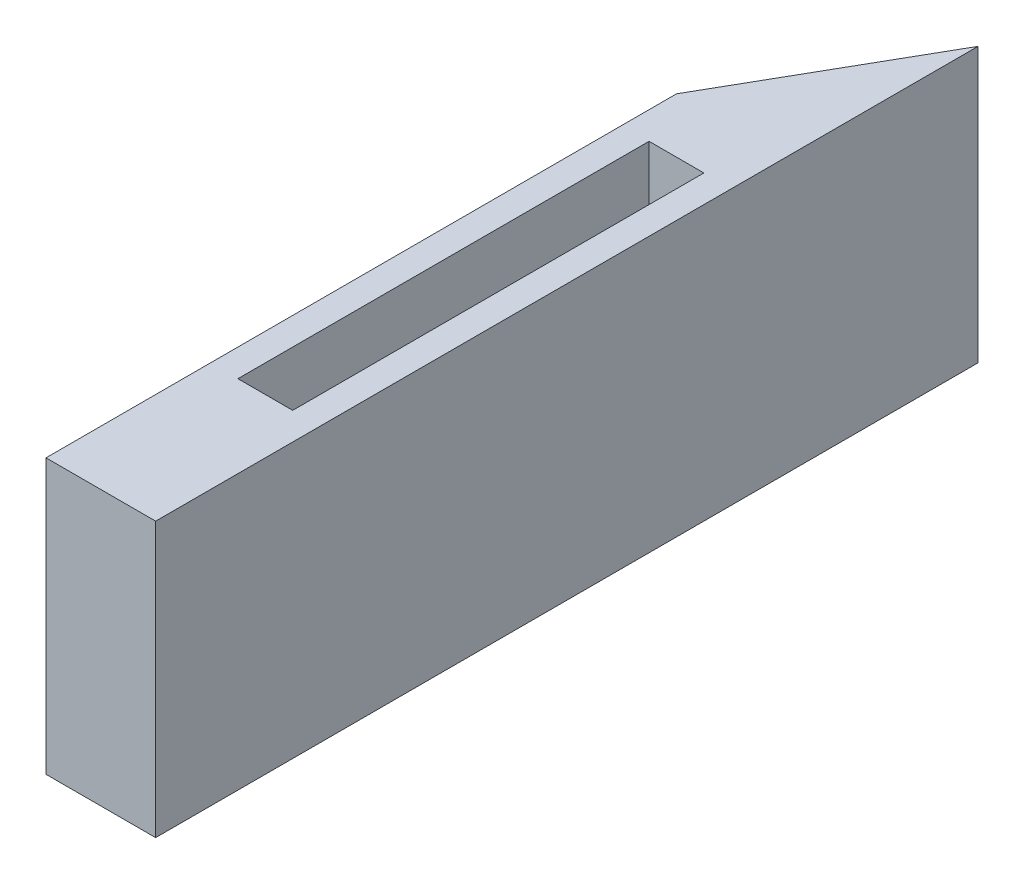
from build123d import *

# Parameters (mm, degrees)
SKETCH_1_W          = 30
SKETCH_1_H          = 10
EXTRUDE_1_DEPTH     = 4
SKETCH_2_W          = 2
SKETCH_2_H          = 15
CUT_EXTRUDE_1_DEPTH = 32.874754901
CUT_EXTRUDE_2_DEPTH = 32.874754901


with BuildPart() as part:
    # Эскиз1 → Бобышка-Вытянуть1 (new body)
    with BuildSketch(Plane(origin=(0, 0, 0), x_dir=(0, 0, -1), z_dir=(1, 0, 0))):
        with Locations((15, 5)):
            Rectangle(SKETCH_1_W, SKETCH_1_H)
    extrude(amount=EXTRUDE_1_DEPTH)

    # Эскиз2 → Вырез-Вытянуть1 (cut, through all)
    with BuildSketch(Plane(origin=(0, 10, 0), x_dir=(1, 0, 0), z_dir=(0, 1, 0))):
        with Locations((2, 13.5)):
            Rectangle(SKETCH_2_W, SKETCH_2_H)
    extrude(amount=-CUT_EXTRUDE_1_DEPTH, mode=Mode.SUBTRACT)

    # Эскиз3 → Вырез-Вытянуть2 (cut, through all)
    with BuildSketch(Plane(origin=(0, 10, 0), x_dir=(1, 0, 0), z_dir=(0, 1, 0))):
        Polygon((0, 23), (0, 30), (4, 30), align=None)
    extrude(amount=-CUT_EXTRUDE_2_DEPTH, mode=Mode.SUBTRACT)


solid = part.part
